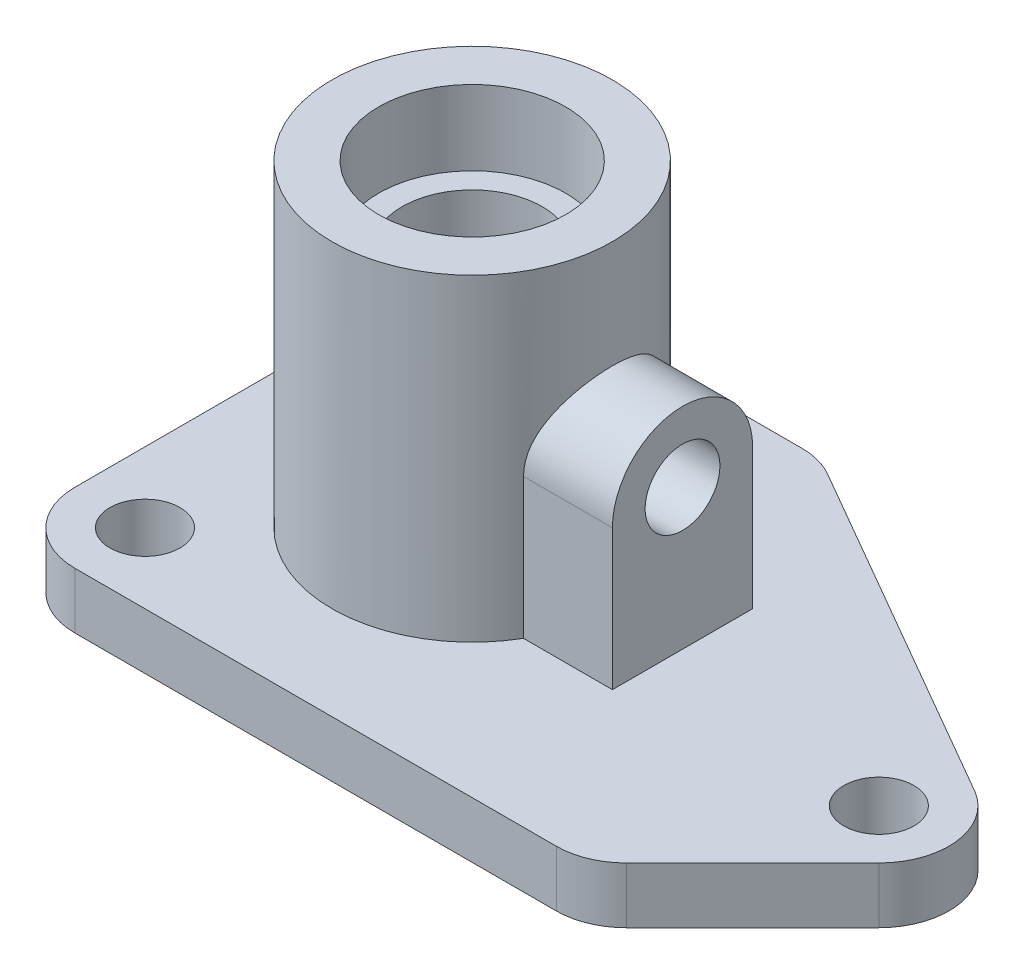
from build123d import *

# Parameters (mm, degrees)
SKETCH1_R                = 7.5
BOSS_EXTRUDE1_DEPTH      = 12
SKETCH3_R                = 30
BOSS_EXTRUDE2_DEPTH      = 68
HOLE1_D                  = 30
HOLE1_DEPTH              = 80
HOLE1_CBORE_D            = 40
HOLE1_CBORE_DEPTH        = 16
HOLE1_TIP                = 9.012909285
BOSS_EXTRUDE3_REACH      = 135.884
BOSS_EXTRUDE3_END_RADIUS = 30
CUT_EXTRUDE1_REACH       = 135.884
CUT_EXTRUDE1_END_RADIUS  = 15
SKETCH11_R               = 8


with BuildPart() as part:
    # Sketch1 → Boss-Extrude1 (new body)
    with BuildSketch(Plane(origin=(0, 0, 0), x_dir=(1, 0, 0), z_dir=(0, 1, 0))):
        with BuildLine():
            Line((-50, 35), (-50, -35))
            ThreePointArc((-50, -35), (-45.606601718, -45.606601718), (-35, -50))
            Line((-35, -50), (68, -50))
            ThreePointArc((68, -50), (73.740251485, -48.858192988), (78.606601718, -45.606601718))
            Line((78.606601718, -45.606601718), (105.606601718, -18.606601718))
            ThreePointArc((105.606601718, -18.606601718), (109.871672921, -6.042107117), (102.5, 4.990381057))
            Line((102.5, 4.990381057), (28.021815275, 47.990381057))
            ThreePointArc((28.021815275, 47.990381057), (24.404100951, 49.488887394), (20.521815275, 50))
            Line((20.521815275, 50), (-35, 50))
            ThreePointArc((-35, 50), (-45.606601718, 45.606601718), (-50, 35))
        make_face()
        with Locations(Location((95, -8, 0), (0, 0, 270))):
            Circle(SKETCH1_R, mode=Mode.SUBTRACT)
        with Locations(Location((-35, 35, 0), (0, 0, 270))):
            Circle(SKETCH1_R, mode=Mode.SUBTRACT)
        with Locations(Location((-35, -35, 0), (0, 0, 270))):
            Circle(SKETCH1_R, mode=Mode.SUBTRACT)
    extrude(amount=BOSS_EXTRUDE1_DEPTH)

    # Sketch3 → Boss-Extrude2 (add)
    with BuildSketch(Plane(origin=(0, 12, 0), x_dir=(1, 0, 0), z_dir=(0, 1, 0))):
        with Locations(Location((0, 0, 0), (0, 0, 270))):
            Circle(SKETCH3_R)
    extrude(amount=BOSS_EXTRUDE2_DEPTH)

    # Hole1
    with Locations(Plane(origin=(0, 80, 0), x_dir=(1, 0, 0), z_dir=(0, 1, 0))):
        with Locations((0, 0)):
            CounterBoreHole(HOLE1_D / 2, HOLE1_CBORE_D / 2, HOLE1_CBORE_DEPTH, depth=HOLE1_DEPTH)
            with Locations((0, 0, -(HOLE1_DEPTH + HOLE1_TIP / 2))):  # 118° drill point
                Cone(0, HOLE1_D / 2, HOLE1_TIP, mode=Mode.SUBTRACT)

    # Boss-Extrude3: up to this cylinder (the profile starts outside it)
    boss_extrude3_end = Plane(origin=(0, 33.024623, 0), z_dir=(0, -1, 0)) * Cylinder(BOSS_EXTRUDE3_END_RADIUS, 332.768, mode=Mode.PRIVATE)
    # Sketch10 → Boss-Extrude3 (add, up to the surface)
    with BuildSketch(Plane(origin=(45, 0, 0), x_dir=(0, 0, -1), z_dir=(1, 0, 0)), mode=Mode.PRIVATE) as boss_extrude3_sk1:
        with BuildLine():
            Line((-15, 42), (-15, 12))
            Line((-15, 12), (15, 12))
            Line((15, 12), (15, 42))
            ThreePointArc((15, 42), (0, 57), (-15, 42))
        make_face()
    boss_extrude3_tool1 = extrude(boss_extrude3_sk1.sketch, amount=-BOSS_EXTRUDE3_REACH, mode=Mode.PRIVATE) - boss_extrude3_end
    add(boss_extrude3_tool1.solids().sort_by_distance((45, 33.024623, 0))[0])

    # Cut-Extrude1: up to this cylinder (the profile starts outside it)
    cut_extrude1_end = Plane(origin=(0, 42, 0), z_dir=(0, 1, 0)) * Cylinder(CUT_EXTRUDE1_END_RADIUS, 302.768, mode=Mode.PRIVATE)
    # Sketch11 → Cut-Extrude1 (cut, up to the surface)
    with BuildSketch(Plane(origin=(45, 0, 0), x_dir=(0, 0, -1), z_dir=(1, 0, 0)), mode=Mode.PRIVATE) as cut_extrude1_sk1:
        with Locations((0, 42)):
            Circle(SKETCH11_R)
    cut_extrude1_tool1 = extrude(cut_extrude1_sk1.sketch, amount=-CUT_EXTRUDE1_REACH, mode=Mode.PRIVATE) - cut_extrude1_end
    add(cut_extrude1_tool1.solids().sort_by_distance((45, 42, 0))[0], mode=Mode.SUBTRACT)


solid = part.part
